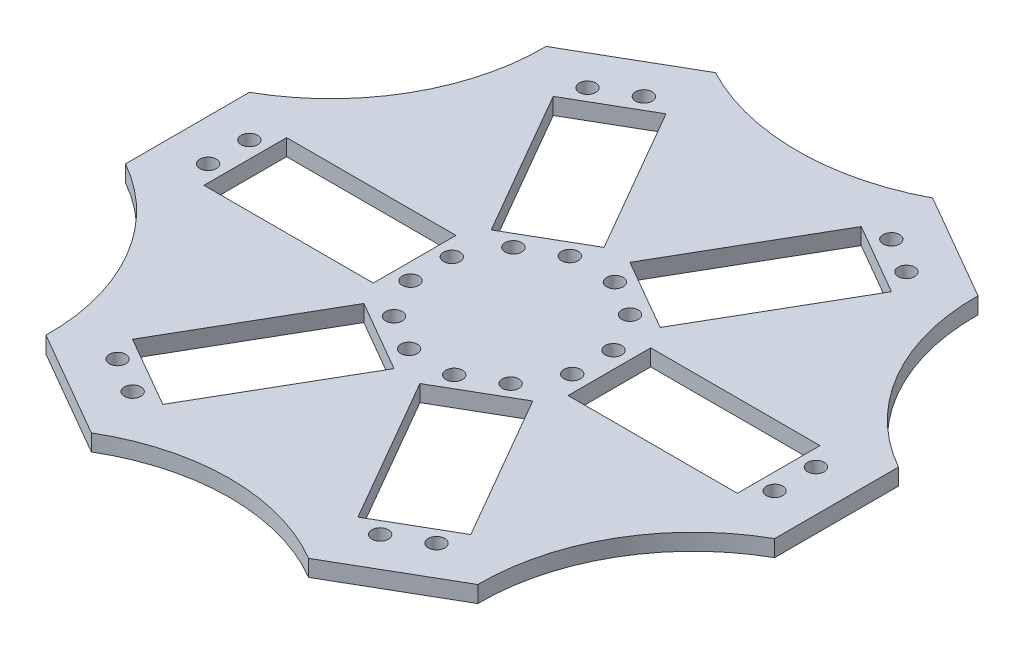
from build123d import *

# Parameters (mm, degrees)
EXTRUDE_1_DEPTH          = 4
SKETCH_3_R               = 2
SKETCH_3_W               = 41
SKETCH_3_H               = 20
CUT_EXTRUDE_3_DEPTH      = 25
PATTERN_CIRCULAR_1_COUNT = 6


with BuildPart() as part:
    # 草图1 → 凸台-拉伸1 (new body)
    with BuildSketch(Plane(origin=(0, 0, 0), x_dir=(1, 0, 0), z_dir=(0, 1, 0))):
        with BuildLine():
            Line((78.581168228, 15), (78.581168228, -15))
            ThreePointArc((78.581168228, -15), (59.197125657, -34.177476433), (52.280965171, -60.553287944))
            Line((52.280965171, -60.553287944), (26.300203057, -75.553287944))
            ThreePointArc((26.300203057, -75.553287944), (0, -68.354952867), (-26.300203057, -75.553287944))
            Line((-26.300203057, -75.553287944), (-52.280965171, -60.553287944))
            ThreePointArc((-52.280965171, -60.553287944), (-59.197125657, -34.177476433), (-78.581168228, -15))
            Line((-78.581168228, -15), (-78.581168228, 15))
            ThreePointArc((-78.581168228, 15), (-59.197125657, 34.177476433), (-52.280965171, 60.553287944))
            Line((-52.280965171, 60.553287944), (-26.300203057, 75.553287944))
            ThreePointArc((-26.300203057, 75.553287944), (0, 69.054660136), (26.300203057, 75.553287944))
            Line((26.300203057, 75.553287944), (52.280965171, 60.553287944))
            ThreePointArc((52.280965171, 60.553287944), (59.197125657, 34.177476433), (78.581168228, 15))
        make_face()
    extrude(amount=EXTRUDE_1_DEPTH)

    # 草图3 → 切除-拉伸3 (cut, symmetric)
    with BuildSketch(Plane(origin=(0, 0, 0), x_dir=(1, 0, 0), z_dir=(0, 1, 0))):
        with Locations(Location((68.581168228, 5, 0), (0, 0, 270))):
            Circle(SKETCH_3_R)
        with Locations(Location((68.581168228, -5, 0), (0, 0, 270))):
            Circle(SKETCH_3_R)
        with Locations(Location((19.581168228, 5, 0), (0, 0, 270))):
            Circle(SKETCH_3_R)
        with Locations(Location((19.581168228, -5, 0), (0, 0, 270))):
            Circle(SKETCH_3_R)
        with Locations((44.081168228, 0)):
            Rectangle(SKETCH_3_W, SKETCH_3_H)
    cut_extrude_3 = extrude(amount=CUT_EXTRUDE_3_DEPTH, both=True, mode=Mode.SUBTRACT)

    # 阵列(圆周)1: 切除-拉伸3 ×6 about axis
    pattern_circular_1_axis = Axis((0, 0, 0), (0, 1, 0))
    for i in range(1, PATTERN_CIRCULAR_1_COUNT):
        add(cut_extrude_3.rotate(pattern_circular_1_axis, i * 360 / PATTERN_CIRCULAR_1_COUNT), mode=Mode.SUBTRACT)


solid = part.part
